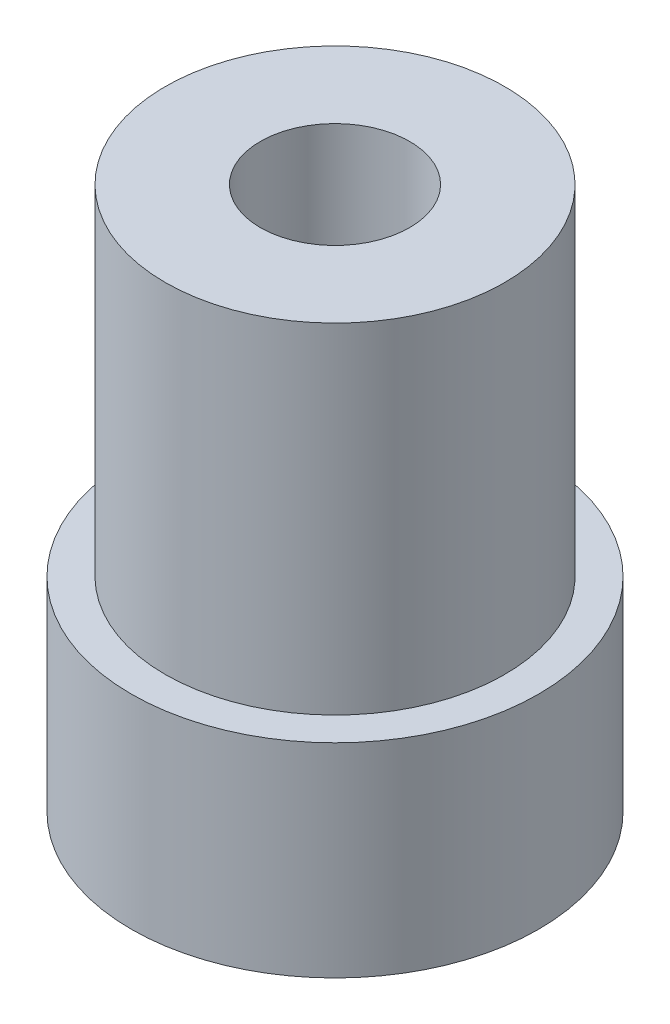
from build123d import *

# Parameters (mm, degrees)
F_1_0MM_1_D = 2.2


with BuildPart() as part:
    # 草圖1 → 旋轉1 (revolve)
    with BuildSketch(Plane(origin=(0, 0, 0), x_dir=(0, 0, -1), z_dir=(1, 0, 0)), mode=Mode.PRIVATE) as revolve_1_sk:
        Polygon((0, 0), (3, 0), (3, 3), (2.5, 3), (2.5, 8), (0, 8), align=None)
    revolve(revolve_1_sk.sketch.rotate(Axis((0, 8, 0), (0, -1, 0)), 180), axis=Axis((0, 8, 0), (0, -1, 0)))

    # Ø1.0mm 定位孔1 (through all)
    with Locations(Plane(origin=(0, 8, 0), x_dir=(1, 0, 0), z_dir=(0, 1, 0))):
        with Locations((0, 0)):
            Hole(F_1_0MM_1_D / 2)


solid = part.part
